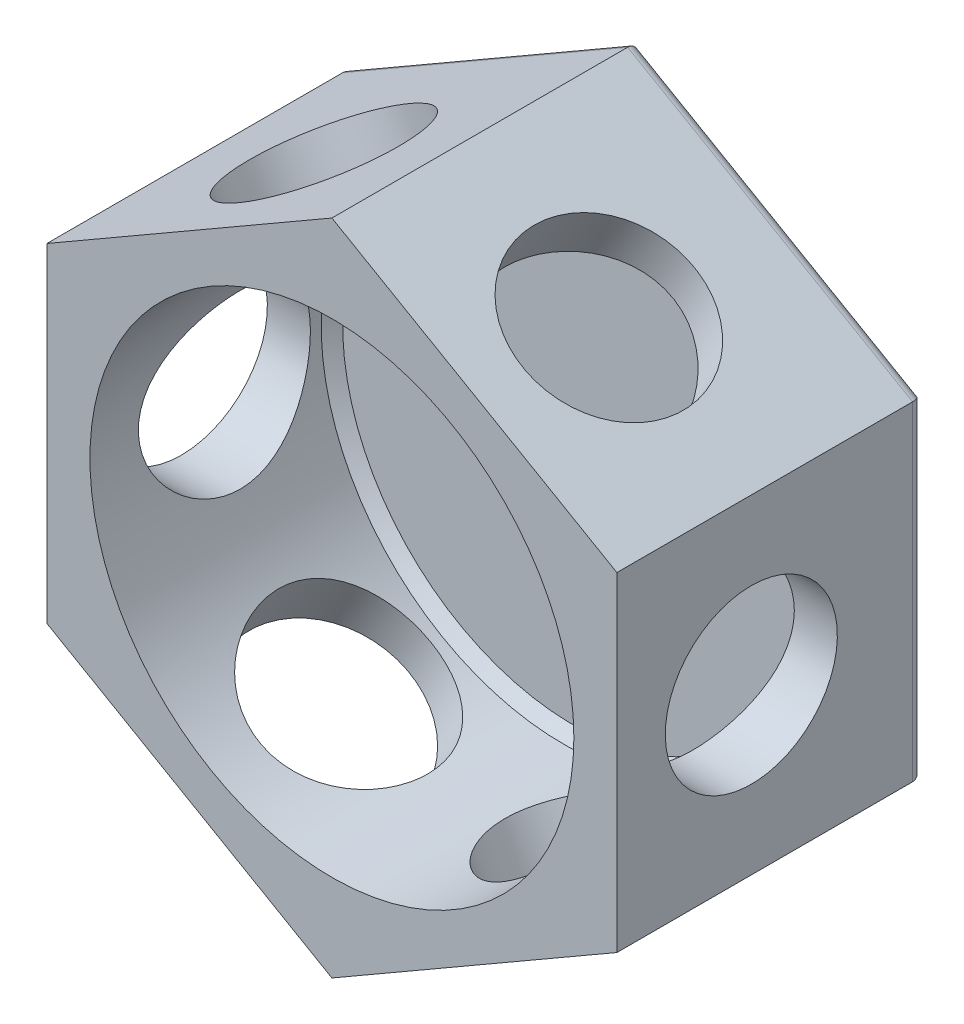
from build123d import *

# Parameters (mm, degrees)
BOSS_EXTRUDE1_DEPTH      = 25
BOSS_EXTRUDE1_DEPTH_BACK = 32
SKETCH2_R                = 45
CUT_EXTRUDE1_DEPTH       = 45
CUT_EXTRUDE2_REACH       = 139.165
CUT_EXTRUDE2_END_RADIUS  = 45
SKETCH3_R                = 16
CIRPATTERN1_COUNT        = 6
CHAMFER2_SIZE            = 2
FILLET1_R                = 2


with BuildPart() as part:
    # Sketch1 → Boss-Extrude1 (new, two sides: drawn at the far end of the back side and taken through both)
    with BuildSketch(Plane.XY.offset(-BOSS_EXTRUDE1_DEPTH_BACK)):
        Polygon((0, 61.199128534), (-53, 30.599564267), (-53, -30.599564267), (0, -61.199128534), (53, -30.599564267), (53, 30.599564267), align=None)
    extrude(amount=BOSS_EXTRUDE1_DEPTH + BOSS_EXTRUDE1_DEPTH_BACK)

    # Sketch2 → Cut-Extrude1 (cut)
    with BuildSketch(Plane.XY.offset(25)):
        Circle(SKETCH2_R)
    extrude(amount=-CUT_EXTRUDE1_DEPTH, mode=Mode.SUBTRACT)

    # Cut-Extrude2: up to this cylinder (the profile starts outside it)
    cut_extrude2_end = Plane(origin=(0, 0, 0), z_dir=(0, 0, 1)) * Cylinder(CUT_EXTRUDE2_END_RADIUS, 369.33, mode=Mode.PRIVATE)
    # Sketch3 → Cut-Extrude2 (cut, up to the surface)
    with BuildSketch(Plane(origin=(26.5, -45.899346401, 0), x_dir=(0.8660254037844387, 0.4999999999999999, 0), z_dir=(0.4999999999999999, -0.8660254037844387, 0)), mode=Mode.PRIVATE) as cut_extrude2_sk1:
        Circle(SKETCH3_R)
    cut_extrude2_tool1 = extrude(cut_extrude2_sk1.sketch, amount=-CUT_EXTRUDE2_REACH, mode=Mode.PRIVATE) - cut_extrude2_end
    cut_extrude2 = cut_extrude2_tool1.solids().sort_by_distance((26.5, -45.899346, 0))[0]
    add(cut_extrude2, mode=Mode.SUBTRACT)

    # CirPattern1: Cut-Extrude2 ×6 about axis
    cirpattern1_axis = Axis((0, 0, 25), (0, 0, 1))
    for i in range(1, CIRPATTERN1_COUNT):
        add(cut_extrude2.rotate(cirpattern1_axis, i * 360 / CIRPATTERN1_COUNT), mode=Mode.SUBTRACT)

    # Chamfer2
    chamfer2_edges = [part.edges().sort_by_distance(p)[0] for p in [
        (-45, 0, -20),
    ]]
    chamfer(chamfer2_edges, length=CHAMFER2_SIZE)

    # Fillet1
    fillet1_edges = [part.edges().sort_by_distance(p)[0] for p in [
        (-53, 0, -32),
        (-26.5, -45.899346401, -32),
        (26.5, -45.899346401, -32),
        (53, 0, -32),
        (26.5, 45.899346401, -32),
        (-26.5, 45.899346401, -32),
    ]]
    fillet(fillet1_edges, radius=FILLET1_R)


solid = part.part
